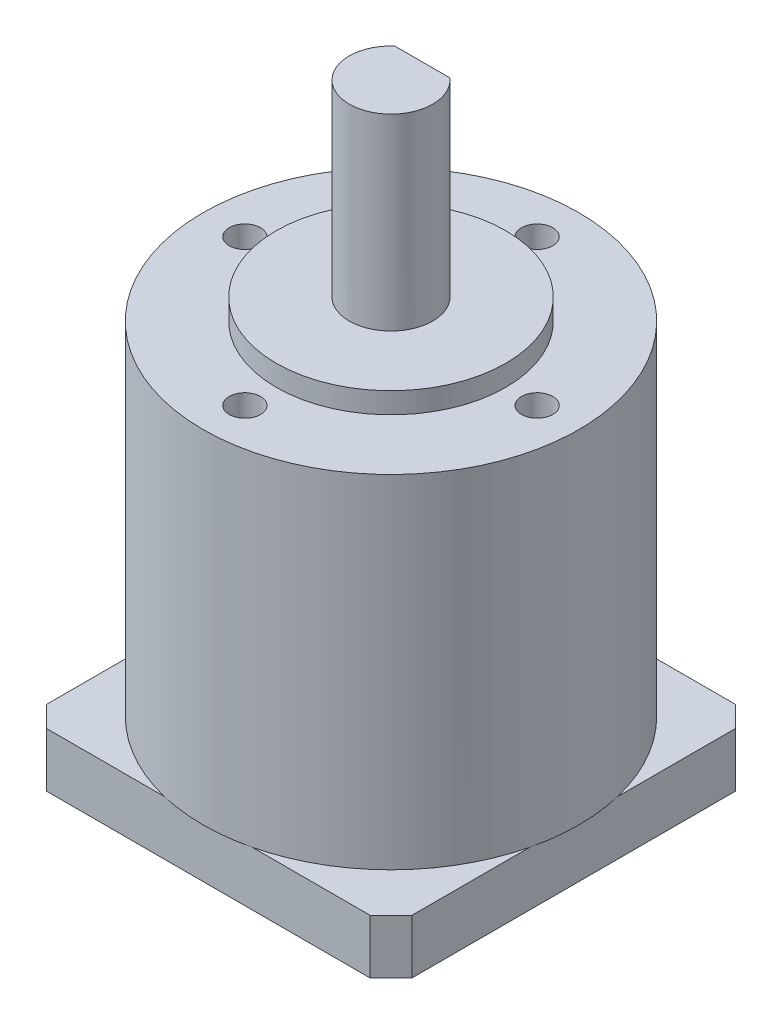
from build123d import *

# Parameters (mm, degrees)
SKETCH_1_W          = 35
SKETCH_1_H          = 35
EXTRUDE_1_DEPTH     = 5.2
SKETCH_2_R          = 18
EXTRUDE_2_DEPTH     = 32.8
SKETCH_3_R          = 11
EXTRUDE_3_DEPTH     = 2
SKETCH_4_R          = 4
EXTRUDE_4_DEPTH     = 18
SKETCH_5_W          = 10.54681648
SKETCH_5_H          = 7.766292135
CUT_EXTRUDE_1_DEPTH = 15
CHAMFER_1_SIZE      = 2
SKETCH_6_R          = 1.5
CUT_EXTRUDE_2_DEPTH = 6


with BuildPart() as part:
    # 草图1 → 凸台-拉伸1 (new body)
    with BuildSketch(Plane(origin=(0, 0, 0), x_dir=(1, 0, 0), z_dir=(0, 1, 0))):
        Rectangle(SKETCH_1_W, SKETCH_1_H)
    extrude(amount=EXTRUDE_1_DEPTH)

    # 草图2 → 凸台-拉伸2 (add)
    with BuildSketch(Plane(origin=(0, 5.2, 0), x_dir=(1, 0, 0), z_dir=(0, 1, 0))):
        with Locations(Location((0, 0, 0), (0, 0, 76.463797263))):
            Circle(SKETCH_2_R)
    extrude(amount=EXTRUDE_2_DEPTH)

    # 草图3 → 凸台-拉伸3 (add)
    with BuildSketch(Plane(origin=(0, 38, 0), x_dir=(1, 0, 0), z_dir=(0, 1, 0))):
        with Locations(Location((0, 0, 0), (0, 0, 270))):
            Circle(SKETCH_3_R)
    extrude(amount=EXTRUDE_3_DEPTH)

    # 草图4 → 凸台-拉伸4 (add)
    with BuildSketch(Plane(origin=(0, 40, 0), x_dir=(1, 0, 0), z_dir=(0, 1, 0))):
        with Locations(Location((0, 0, 0), (0, 0, 270))):
            Circle(SKETCH_4_R)
    extrude(amount=EXTRUDE_4_DEPTH)

    # 草图5 → 切除-拉伸1 (cut)
    with BuildSketch(Plane(origin=(0, 58, 0), x_dir=(1, 0, 0), z_dir=(0, 1, 0))):
        with Locations((0, 6.883146068)):
            Rectangle(SKETCH_5_W, SKETCH_5_H)
    extrude(amount=-CUT_EXTRUDE_1_DEPTH, mode=Mode.SUBTRACT)

    # 倒角1
    chamfer_1_edges = [part.edges().sort_by_distance(p)[0] for p in [
        (17.5, 2.6, 17.5),
        (-17.5, 2.6, 17.5),
        (-17.5, 2.6, -17.5),
        (17.5, 2.6, -17.5),
    ]]
    chamfer(chamfer_1_edges, length=CHAMFER_1_SIZE)

    # 草图6 → 切除-拉伸2 (cut)
    with BuildSketch(Plane(origin=(0, 38, 0), x_dir=(1, 0, 0), z_dir=(0, 1, 0))):
        with Locations(Location((0, 14, 0), (0, 0, 270))):
            Circle(SKETCH_6_R)
        with Locations(Location((14, 0, 0), (0, 0, 270))):
            Circle(SKETCH_6_R)
        with Locations(Location((0, -14, 0), (0, 0, 270))):
            Circle(SKETCH_6_R)
        with Locations(Location((-14, 0, 0), (0, 0, 270))):
            Circle(SKETCH_6_R)
    extrude(amount=-CUT_EXTRUDE_2_DEPTH, mode=Mode.SUBTRACT)


solid = part.part
